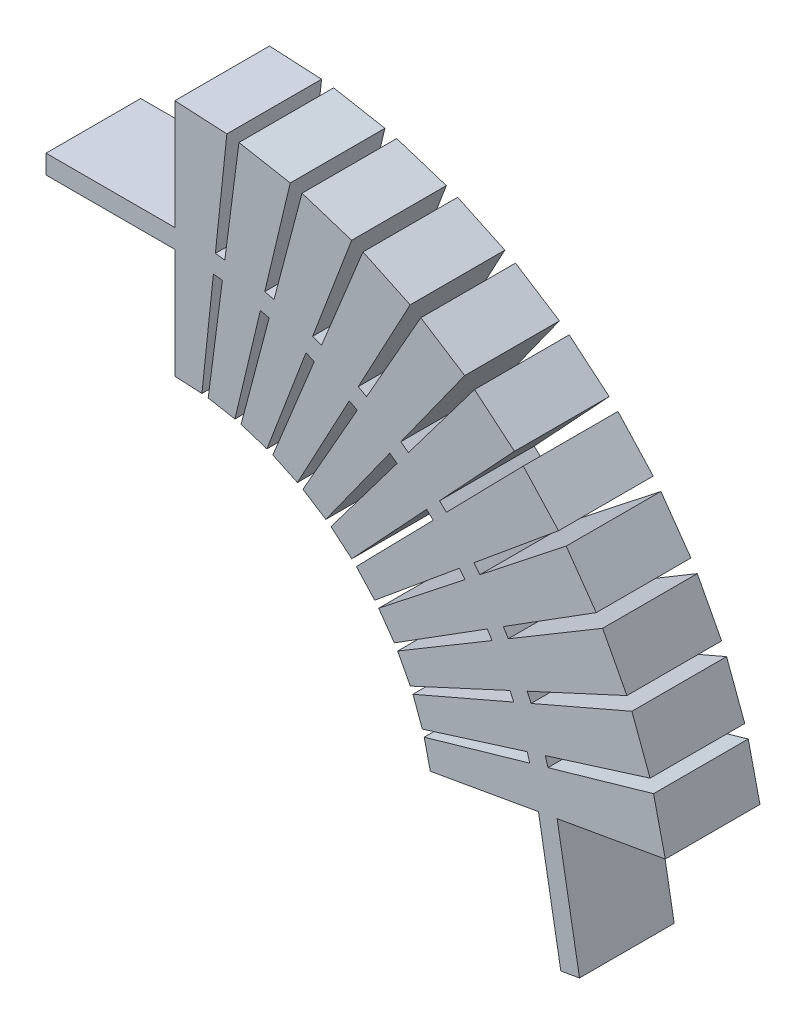
from build123d import *

# Parameters (mm, degrees)
AUFSATZ_LINEAR_AUSTRAGEN1_DEPTH = 5
AUFSATZ_LINEAR_AUSTRAGEN2_DEPTH = 5
KREISMUSTER1_COUNT              = 11
KREISMUSTER1_ANGLE              = 74
AUFSATZ_LINEAR_AUSTRAGEN4_DEPTH = 5
AUFSATZ_LINEAR_AUSTRAGEN3_DEPTH = 5
KREISMUSTER4_COUNT              = 11
KREISMUSTER4_ANGLE              = 74
SKIZZE5_W                       = 10
SKIZZE5_H                       = 2
AUFSATZ_LINEAR_AUSTRAGEN5_DEPTH = 13.6
SKIZZE6_W                       = 2
SKIZZE6_H                       = 10
AUFSATZ_LINEAR_AUSTRAGEN6_DEPTH = 13.6


with BuildPart() as part:
    # Skizze1 → Aufsatz-Linear austragen1 (new, symmetric)
    with BuildSketch(Plane.XY):
        with BuildLine():
            Line((0, 41), (0, 40))
            ThreePointArc((0, 40), (25.711504387, 30.641777725), (39.39231012, 6.945927107))
            Line((39.39231012, 6.945927107), (40.377117874, 7.119575284))
            ThreePointArc((40.377117874, 7.119575284), (26.354291997, 31.407822168), (0, 41))
        make_face()
    extrude(amount=AUFSATZ_LINEAR_AUSTRAGEN1_DEPTH, both=True)

    # Skizze2 → Aufsatz-Linear austragen2 (add, symmetric)
    with BuildSketch(Plane.XY):
        with BuildLine():
            Line((0, 52.6), (0, 41))
            ThreePointArc((0, 41), (2.145774206, 40.943810925), (4.285666994, 40.77539771))
            Line((4.285666994, 40.77539771), (5.498197168, 52.311851696))
            Line((5.498197168, 52.311851696), (0, 52.6))
        make_face()
    aufsatz_linear_austragen2 = extrude(amount=AUFSATZ_LINEAR_AUSTRAGEN2_DEPTH, both=True)

    # Kreismuster1: Aufsatz-Linear austragen2 ×11 about axis
    kreismuster1_axis = Axis((0, 0, -5.5), (0, 0, -1))
    for i in range(1, KREISMUSTER1_COUNT):
        add(aufsatz_linear_austragen2.rotate(kreismuster1_axis, i * KREISMUSTER1_ANGLE / (KREISMUSTER1_COUNT - 1)))

    # Skizze4 → Aufsatz-Linear austragen4 (add, symmetric)
    with BuildSketch(Plane.XY):
        with BuildLine():
            Line((0, 40), (0, 39))
            ThreePointArc((0, 39), (25.068716778, 29.875733282), (38.407502367, 6.772278929))
            Line((38.407502367, 6.772278929), (39.39231012, 6.945927107))
            ThreePointArc((39.39231012, 6.945927107), (25.711504387, 30.641777725), (0, 40))
        make_face()
    extrude(amount=AUFSATZ_LINEAR_AUSTRAGEN4_DEPTH, both=True)

    # Skizze3 → Aufsatz-Linear austragen3 (add, symmetric)
    with BuildSketch(Plane.XY):
        Polygon((4.181138531, 39.780875815), (0, 40), (0, 27.4), (2.864079894, 27.249899933), align=None)
    aufsatz_linear_austragen3 = extrude(amount=AUFSATZ_LINEAR_AUSTRAGEN3_DEPTH, both=True)

    # Kreismuster4: Aufsatz-Linear austragen3 ×11 about axis
    kreismuster4_axis = Axis((0, 0, -5.5), (0, 0, -1))
    for i in range(1, KREISMUSTER4_COUNT):
        add(aufsatz_linear_austragen3.rotate(kreismuster4_axis, i * KREISMUSTER4_ANGLE / (KREISMUSTER4_COUNT - 1)))

    # Skizze5 → Aufsatz-Linear austragen5 (add)
    with BuildSketch(Plane.ZY):
        with Locations((0, 40)):
            Rectangle(SKIZZE5_W, SKIZZE5_H)
    extrude(amount=AUFSATZ_LINEAR_AUSTRAGEN5_DEPTH)

    # Skizze6 → Aufsatz-Linear austragen6 (add)
    with BuildSketch(Plane(origin=(0, 0, 0), x_dir=(0.9848077530122074, 0.1736481776669343, 0), z_dir=(0.1736481776669343, -0.9848077530122074, 0))):
        with Locations((40, 0)):
            Rectangle(SKIZZE6_W, SKIZZE6_H)
    extrude(amount=AUFSATZ_LINEAR_AUSTRAGEN6_DEPTH)


solid = part.part
